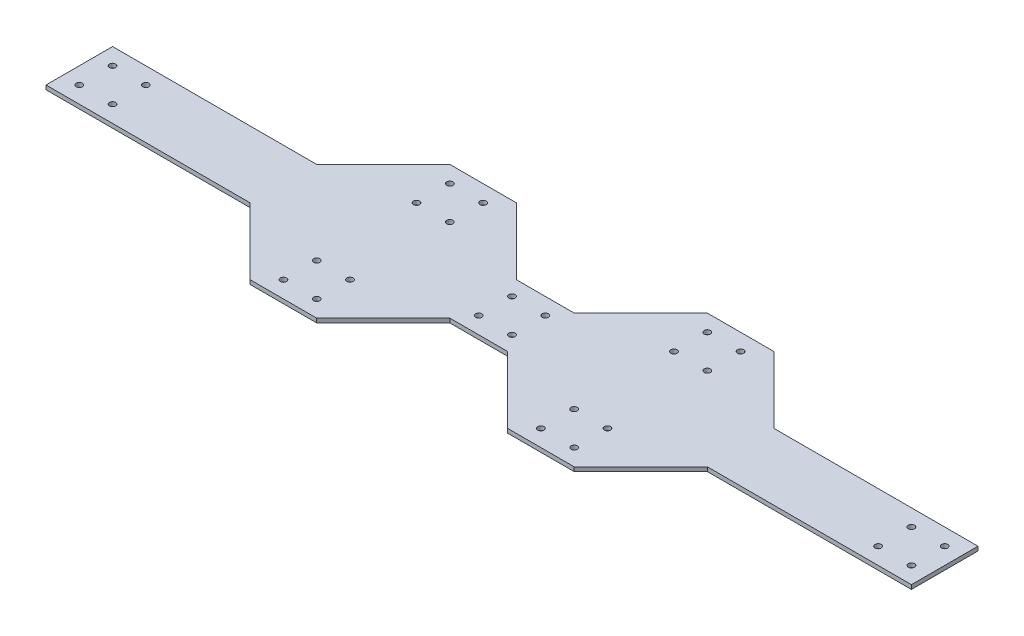
from build123d import *

# Parameters (mm, degrees)
BOSS_EXTRUDE1_DEPTH     = 3.175
CUT_EXTRUDE1_DEPTH      = 339.893140422
CUT_EXTRUDE1_DEPTH_BACK = 339.893140422
SKETCH3_R               = 2.38125


with BuildPart() as part:
    # Sketch2 → Boss-Extrude1 (new body)
    with BuildSketch(Plane(origin=(0, 0, 0), x_dir=(1, 0, 0), z_dir=(0, 1, 0))):
        Polygon((22.0265625, 25.4), (72.8265625, 76.2), (123.6265625, 76.2), (174.4265625, 25.4), (330.2, 25.4), (330.2, -25.4), (174.4265625, -25.4), (123.6265625, -76.2), (72.8265625, -76.2), (22.0265625, -25.4), (-22.0265625, -25.4), (-72.8265625, -76.2), (-123.6265625, -76.2), (-174.4265625, -25.4), (-330.2, -25.4), (-330.2, 25.4), (-174.4265625, 25.4), (-123.6265625, 76.2), (-72.8265625, 76.2), (-22.0265625, 25.4), align=None)
    extrude(amount=BOSS_EXTRUDE1_DEPTH)

    # Sketch3 → Cut-Extrude1 (cut, two sides: drawn at the far end of the back side and taken through both)
    with BuildSketch(Plane(origin=(0, 3.175, 0), x_dir=(1, 0, 0), z_dir=(0, 1, 0)).offset(-CUT_EXTRUDE1_DEPTH_BACK)):
        with Locations(Location((-110.9265625, 63.5, 0), (0, 0, 270))):
            Circle(SKETCH3_R)
        with Locations(Location((-85.5265625, 63.5, 0), (0, 0, 270))):
            Circle(SKETCH3_R)
        with Locations(Location((-110.9265625, 38.1, 0), (0, 0, 270))):
            Circle(SKETCH3_R)
        with Locations(Location((-85.5265625, 38.1, 0), (0, 0, 270))):
            Circle(SKETCH3_R)
        with Locations(Location((-85.5265625, -38.1, 0), (0, 0, 270))):
            Circle(SKETCH3_R)
        with Locations(Location((-110.9265625, -38.1, 0), (0, 0, 270))):
            Circle(SKETCH3_R)
        with Locations(Location((-85.5265625, -63.5, 0), (0, 0, 270))):
            Circle(SKETCH3_R)
        with Locations(Location((-110.9265625, -63.5, 0), (0, 0, 270))):
            Circle(SKETCH3_R)
        with Locations(Location((110.9265625, -63.5, 0), (0, 0, 270))):
            Circle(SKETCH3_R)
        with Locations(Location((85.5265625, -63.5, 0), (0, 0, 270))):
            Circle(SKETCH3_R)
        with Locations(Location((110.9265625, -38.1, 0), (0, 0, 270))):
            Circle(SKETCH3_R)
        with Locations(Location((85.5265625, -38.1, 0), (0, 0, 270))):
            Circle(SKETCH3_R)
        with Locations(Location((85.5265625, 38.1, 0), (0, 0, 270))):
            Circle(SKETCH3_R)
        with Locations(Location((110.9265625, 38.1, 0), (0, 0, 270))):
            Circle(SKETCH3_R)
        with Locations(Location((85.5265625, 63.5, 0), (0, 0, 270))):
            Circle(SKETCH3_R)
        with Locations(Location((110.9265625, 63.5, 0), (0, 0, 270))):
            Circle(SKETCH3_R)
        with Locations(Location((-292.1, -12.7, 0), (0, 0, 270))):
            Circle(SKETCH3_R)
        with Locations(Location((-317.5, -12.7, 0), (0, 0, 270))):
            Circle(SKETCH3_R)
        with Locations(Location((-317.5, 12.7, 0), (0, 0, 270))):
            Circle(SKETCH3_R)
        with Locations(Location((-292.1, 12.7, 0), (0, 0, 270))):
            Circle(SKETCH3_R)
        with Locations(Location((292.1, 12.7, 0), (0, 0, 270))):
            Circle(SKETCH3_R)
        with Locations(Location((317.5, 12.7, 0), (0, 0, 270))):
            Circle(SKETCH3_R)
        with Locations(Location((317.5, -12.7, 0), (0, 0, 270))):
            Circle(SKETCH3_R)
        with Locations(Location((292.1, -12.7, 0), (0, 0, 270))):
            Circle(SKETCH3_R)
        with Locations(Location((-12.7, 12.7, 0), (0, 0, 270))):
            Circle(SKETCH3_R)
        with Locations(Location((12.7, 12.7, 0), (0, 0, 270))):
            Circle(SKETCH3_R)
        with Locations(Location((12.7, -12.7, 0), (0, 0, 270))):
            Circle(SKETCH3_R)
        with Locations(Location((-12.7, -12.7, 0), (0, 0, 270))):
            Circle(SKETCH3_R)
    extrude(amount=CUT_EXTRUDE1_DEPTH + CUT_EXTRUDE1_DEPTH_BACK, mode=Mode.SUBTRACT)


solid = part.part
